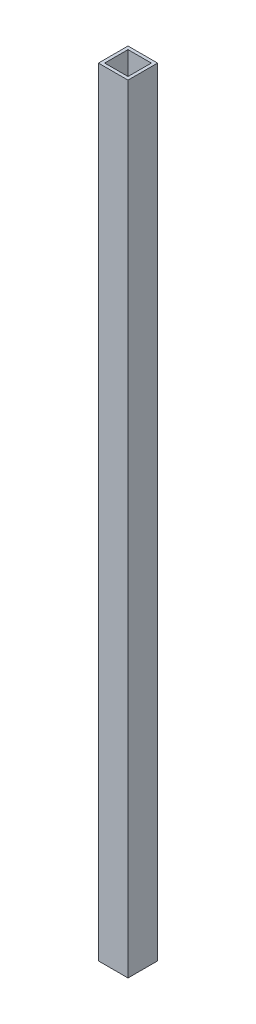
from build123d import *

# Parameters (mm, degrees)
SKETCH1_W           = 19
SKETCH1_H           = 19
SKETCH1_W_2         = 15
SKETCH1_H_2         = 15
EXTRUDE_THIN1_DEPTH = 500


with BuildPart() as part:
    # Sketch1 → Extrude-Thin1 (new body)
    with BuildSketch(Plane(origin=(0, 0, 0), x_dir=(1, 0, 0), z_dir=(0, 1, 0))):
        Rectangle(SKETCH1_W, SKETCH1_H)
        Rectangle(SKETCH1_W_2, SKETCH1_H_2, mode=Mode.SUBTRACT)
    extrude(amount=EXTRUDE_THIN1_DEPTH)


solid = part.part
